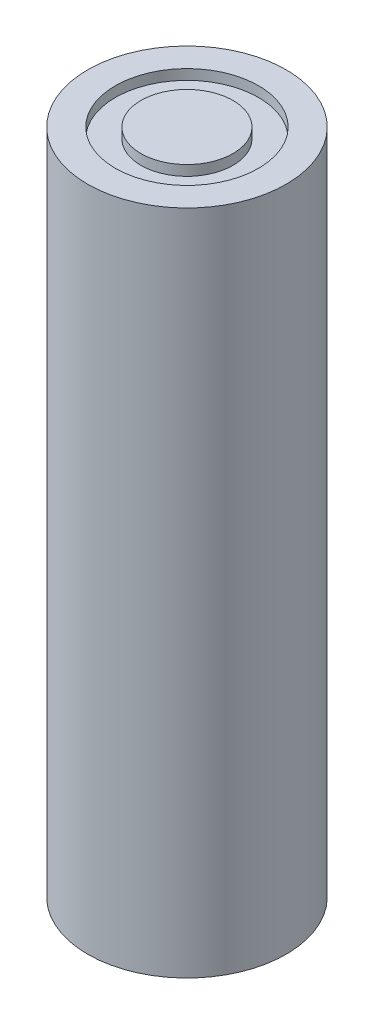
from build123d import *

# Parameters (mm, degrees)
SKETCH2_R           = 9.7
BOSS_EXTRUDE1_DEPTH = 65.2
SKETCH3_R           = 7
SKETCH3_R_2         = 4.5
CUT_EXTRUDE1_DEPTH  = 1


with BuildPart() as part:
    # Sketch2 → Boss-Extrude1 (new body)
    with BuildSketch(Plane(origin=(0, 0, 0), x_dir=(1, 0, 0), z_dir=(0, 1, 0))):
        Circle(SKETCH2_R)
    extrude(amount=BOSS_EXTRUDE1_DEPTH)

    # Sketch3 → Cut-Extrude1 (cut)
    with BuildSketch(Plane(origin=(0, 65.2, 0), x_dir=(1, 0, 0), z_dir=(0, 1, 0))):
        Circle(SKETCH3_R)
        Circle(SKETCH3_R_2, mode=Mode.SUBTRACT)
    extrude(amount=-CUT_EXTRUDE1_DEPTH, mode=Mode.SUBTRACT)


solid = part.part
